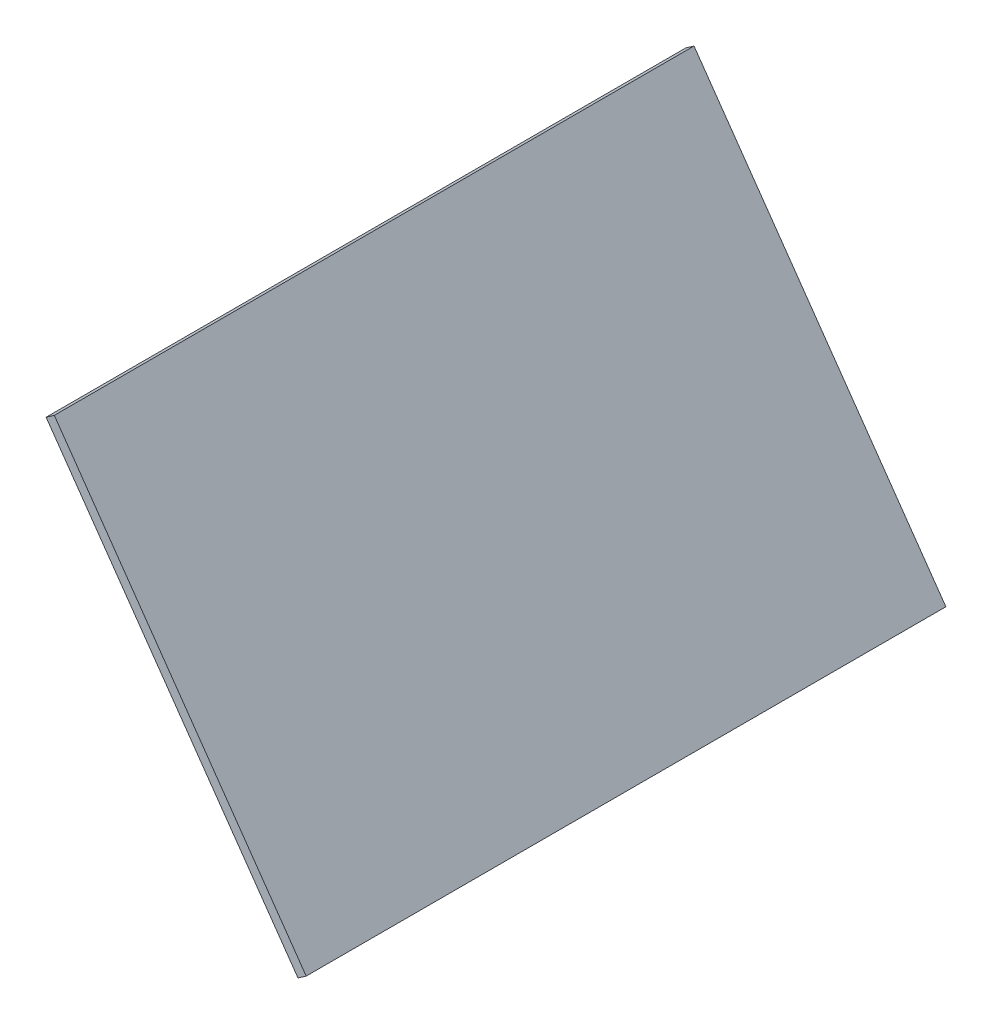
from build123d import *

# Parameters (mm, degrees)
BOSS_EXTRUDE1_DEPTH = 101.6


with BuildPart() as part:
    # Sketch1 → Boss-Extrude1 (new body)
    with BuildSketch(Plane.XY):
        Polygon((-10.797575789, 0.910552593), (-12.09797966, 0), (-52.10040387, 57.129382401), (-50.8, 58.039934994), align=None)
    extrude(amount=BOSS_EXTRUDE1_DEPTH)


solid = part.part
